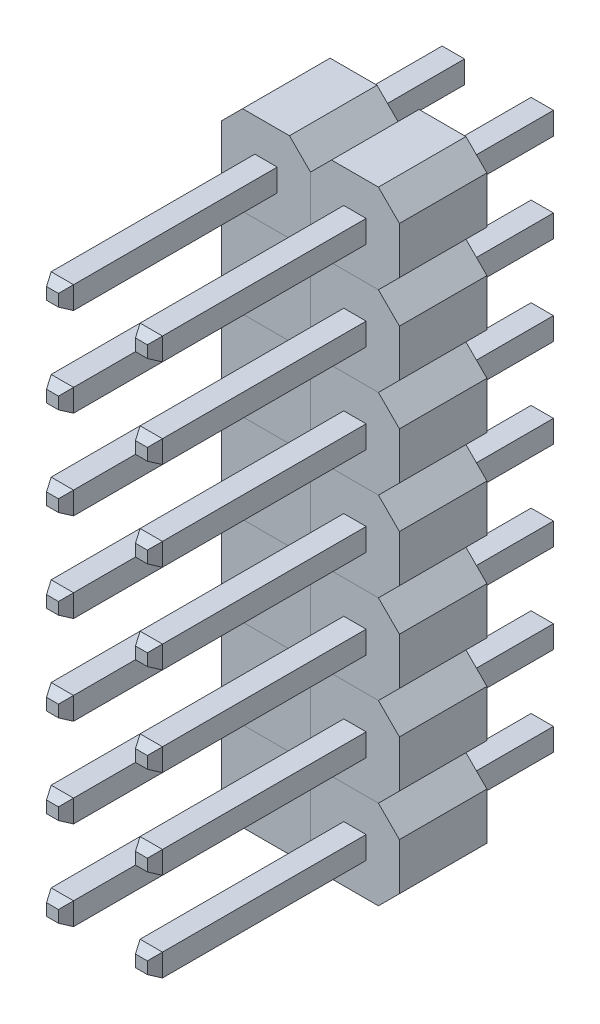
from build123d import *
from OCP.BRepFilletAPI import BRepFilletAPI_MakeChamfer

# Parameters (mm, degrees)
SKETCH_1_W               = 2.54
SKETCH_1_H               = 2.54
EXTRUDE_1_DEPTH          = 2.5
CHAMFER_1_SIZE           = 0.6
EXTRUDE_START            = -8.6
SKETCH_2_W               = 0.64
SKETCH_2_H               = 0.64
EXTRUDE_2_DEPTH          = 11.6
CHAMFER_2_SIZE           = 0.15
CHAMFER_2_SIZE2          = 0.28210897
PATTERN_LINEAR_5_COUNT   = 2
PATTERN_LINEAR_5_PITCH   = 2.54
PATTERN_LINEAR_5_2_COUNT = 7
PATTERN_LINEAR_5_2_PITCH = 2.54


with BuildPart() as part:
    # Эскиз1 → Бобышка-Вытянуть1 (new body)
    with BuildSketch(Plane.XY):
        with Locations((-1.27, -7.62)):
            Rectangle(SKETCH_1_W, SKETCH_1_H)
    extrude(amount=EXTRUDE_1_DEPTH)

    # Фаска1
    chamfer_1_edges = [part.edges().sort_by_distance(p)[0] for p in [
        (0, -8.89, 1.25),
        (-2.54, -8.89, 1.25),
        (-2.54, -6.35, 1.25),
        (0, -6.35, 1.25),
    ]]
    chamfer(chamfer_1_edges, length=CHAMFER_1_SIZE)

    # Эскиз2 → Бобышка-Вытянуть2 (add)
    with BuildSketch(Plane(origin=(0, 0, 0), x_dir=(-1, 0, 0), z_dir=(0, 0, -1)).offset(EXTRUDE_START)):
        with Locations((1.27, -7.62)):
            Rectangle(SKETCH_2_W, SKETCH_2_H)
    extrude(amount=EXTRUDE_2_DEPTH)

    # Фаска2: one chamfer whose edges measure the first distance from different faces: ONE call of the kernel's chamfer builder (chamfer() names one face for all edges)
    chamfer_2_edges_1 = [part.edges().sort_by_distance(p)[0] for p in [
        (-0.95, -7.62, 8.6),
        (-1.27, -7.3, 8.6),
        (-1.59, -7.62, 8.6),
        (-1.27, -7.94, 8.6),
    ]]
    chamfer_2_side_1 = [part.faces().sort_by_distance(p)[0] for p in [
        (-1.27, -7.62, 8.6),
    ]]
    chamfer_2_edges_2 = [part.edges().sort_by_distance(p)[0] for p in [
        (-0.95, -7.62, -3),
    ]]
    chamfer_2_side_2 = [part.faces().sort_by_distance(p)[0] for p in [
        (-0.95, -7.62, -1.5),
    ]]
    chamfer_2_edges_3 = [part.edges().sort_by_distance(p)[0] for p in [
        (-1.27, -7.94, -3),
    ]]
    chamfer_2_side_3 = [part.faces().sort_by_distance(p)[0] for p in [
        (-1.27, -7.94, -1.5),
    ]]
    chamfer_2_edges_4 = [part.edges().sort_by_distance(p)[0] for p in [
        (-1.59, -7.62, -3),
    ]]
    chamfer_2_side_4 = [part.faces().sort_by_distance(p)[0] for p in [
        (-1.59, -7.62, -1.5),
    ]]
    chamfer_2_edges_5 = [part.edges().sort_by_distance(p)[0] for p in [
        (-1.27, -7.3, -3),
    ]]
    chamfer_2_side_5 = [part.faces().sort_by_distance(p)[0] for p in [
        (-1.27, -7.3, -1.5),
    ]]
    chamfer_2 = BRepFilletAPI_MakeChamfer(part.part.solid().wrapped)
    for e in chamfer_2_edges_1:
        chamfer_2.Add(CHAMFER_2_SIZE, CHAMFER_2_SIZE2, e.wrapped, chamfer_2_side_1[0].wrapped)  # the first distance lies on this face
    for e in chamfer_2_edges_2:
        chamfer_2.Add(CHAMFER_2_SIZE, CHAMFER_2_SIZE2, e.wrapped, chamfer_2_side_2[0].wrapped)  # the first distance lies on this face
    for e in chamfer_2_edges_3:
        chamfer_2.Add(CHAMFER_2_SIZE, CHAMFER_2_SIZE2, e.wrapped, chamfer_2_side_3[0].wrapped)  # the first distance lies on this face
    for e in chamfer_2_edges_4:
        chamfer_2.Add(CHAMFER_2_SIZE, CHAMFER_2_SIZE2, e.wrapped, chamfer_2_side_4[0].wrapped)  # the first distance lies on this face
    for e in chamfer_2_edges_5:
        chamfer_2.Add(CHAMFER_2_SIZE, CHAMFER_2_SIZE2, e.wrapped, chamfer_2_side_5[0].wrapped)  # the first distance lies on this face
    add(Compound.cast(chamfer_2.Shape()), mode=Mode.REPLACE)


with BuildPart() as pattern_linear_5_1:
    # Линейный массив5: pattern copy
    add(part.part.moved(Location(Vector(1, 0, 0) * (1 * PATTERN_LINEAR_5_PITCH))))


with BuildPart() as pattern_linear_5_2_1:
    # Pattern Linear 5 2: pattern copy
    add(part.part.moved(Location(Vector(0, 1, 0) * (1 * PATTERN_LINEAR_5_2_PITCH))))


with BuildPart() as pattern_linear_5_2_2:
    # Pattern Linear 5 2: pattern copy
    add(part.part.moved(Location(Vector(0, 1, 0) * (2 * PATTERN_LINEAR_5_2_PITCH))))


with BuildPart() as pattern_linear_5_2_3:
    # Pattern Linear 5 2: pattern copy
    add(part.part.moved(Location(Vector(0, 1, 0) * (3 * PATTERN_LINEAR_5_2_PITCH))))


with BuildPart() as pattern_linear_5_2_4:
    # Pattern Linear 5 2: pattern copy
    add(part.part.moved(Location(Vector(0, 1, 0) * (4 * PATTERN_LINEAR_5_2_PITCH))))


with BuildPart() as pattern_linear_5_2_5:
    # Pattern Linear 5 2: pattern copy
    add(part.part.moved(Location(Vector(0, 1, 0) * (5 * PATTERN_LINEAR_5_2_PITCH))))


with BuildPart() as pattern_linear_5_2_6:
    # Pattern Linear 5 2: pattern copy
    add(part.part.moved(Location(Vector(0, 1, 0) * (6 * PATTERN_LINEAR_5_2_PITCH))))


with BuildPart() as pattern_linear_5_2_7:
    # Pattern Linear 5 2: pattern copy
    add(pattern_linear_5_1.part.moved(Location(Vector(0, 1, 0) * (1 * PATTERN_LINEAR_5_2_PITCH))))


with BuildPart() as pattern_linear_5_2_8:
    # Pattern Linear 5 2: pattern copy
    add(pattern_linear_5_1.part.moved(Location(Vector(0, 1, 0) * (2 * PATTERN_LINEAR_5_2_PITCH))))


with BuildPart() as pattern_linear_5_2_9:
    # Pattern Linear 5 2: pattern copy
    add(pattern_linear_5_1.part.moved(Location(Vector(0, 1, 0) * (3 * PATTERN_LINEAR_5_2_PITCH))))


with BuildPart() as pattern_linear_5_2_10:
    # Pattern Linear 5 2: pattern copy
    add(pattern_linear_5_1.part.moved(Location(Vector(0, 1, 0) * (4 * PATTERN_LINEAR_5_2_PITCH))))


with BuildPart() as pattern_linear_5_2_11:
    # Pattern Linear 5 2: pattern copy
    add(pattern_linear_5_1.part.moved(Location(Vector(0, 1, 0) * (5 * PATTERN_LINEAR_5_2_PITCH))))


with BuildPart() as pattern_linear_5_2_12:
    # Pattern Linear 5 2: pattern copy
    add(pattern_linear_5_1.part.moved(Location(Vector(0, 1, 0) * (6 * PATTERN_LINEAR_5_2_PITCH))))


solid = Compound([part.part, pattern_linear_5_1.part, pattern_linear_5_2_1.part, pattern_linear_5_2_2.part, pattern_linear_5_2_3.part, pattern_linear_5_2_4.part, pattern_linear_5_2_5.part, pattern_linear_5_2_6.part, pattern_linear_5_2_7.part, pattern_linear_5_2_8.part, pattern_linear_5_2_9.part, pattern_linear_5_2_10.part, pattern_linear_5_2_11.part, pattern_linear_5_2_12.part])
